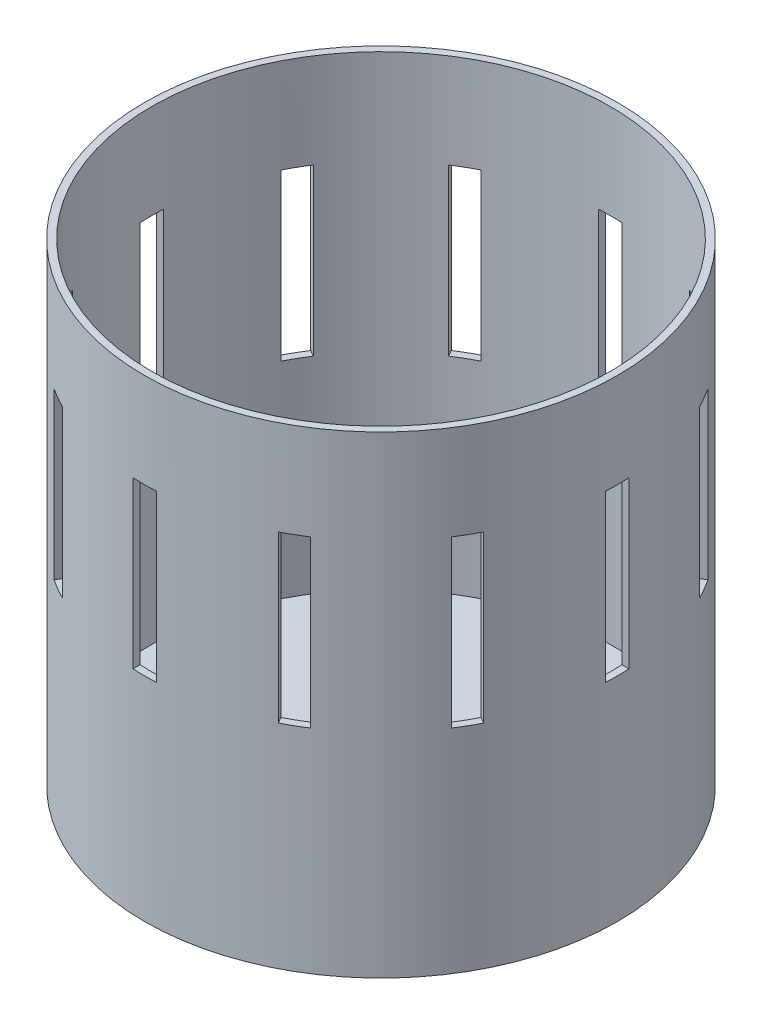
from build123d import *

# Parameters (mm, degrees)
CROQUIS3_R            = 48.5
CORTAR_EXTRUIR1_DEPTH = 98.5
CROQUIS4_R            = 1
CORTAR_EXTRUIR2_DEPTH = 98.5
CROQUIS6_W            = 5
CROQUIS6_H            = 35
CORTAR_EXTRUIR3_DEPTH = 98.5
MATRIZC1_COUNT        = 12


with BuildPart() as part:
    # Croquis2 → Revolución2 (revolve)
    with BuildSketch(Plane.XY, mode=Mode.PRIVATE) as revoluci_n2_sk:
        Polygon((0, 0), (-10, 0), (-10, 5), (-50, 5), (-50, 105), (0, 105), align=None)
    revolve(revoluci_n2_sk.sketch.rotate(Axis((0, 0, 0), (0, 1, 0)), 270), axis=Axis((0, 0, 0), (0, 1, 0)))

    # Croquis3 → Cortar-Extruir1 (cut)
    with BuildSketch(Plane(origin=(0, 105, 0), x_dir=(1, 0, 0), z_dir=(0, 1, 0))):
        with Locations(Location((0, 0, 0), (0, 0, 270))):
            Circle(CROQUIS3_R)
    extrude(amount=-CORTAR_EXTRUIR1_DEPTH, mode=Mode.SUBTRACT)

    # Croquis4 → Cortar-Extruir2 (cut)
    with BuildSketch(Plane.XZ):
        with Locations(Location((0, 0, 0), (0, 0, 270))):
            Circle(CROQUIS4_R)
    extrude(amount=-CORTAR_EXTRUIR2_DEPTH, mode=Mode.SUBTRACT)

    # Croquis6 → Cortar-Extruir3 (cut)
    with BuildSketch(Plane.XY):
        with Locations((0, 67.5)):
            Rectangle(CROQUIS6_W, CROQUIS6_H)
    cortar_extruir3 = extrude(amount=-CORTAR_EXTRUIR3_DEPTH, mode=Mode.SUBTRACT)

    # MatrizC1: Cortar-Extruir3 ×12 about axis
    matrizc1_axis = Axis((0, 0, 0), (0, 1, 0))
    for i in range(1, MATRIZC1_COUNT):
        add(cortar_extruir3.rotate(matrizc1_axis, i * 360 / MATRIZC1_COUNT), mode=Mode.SUBTRACT)


solid = part.part
